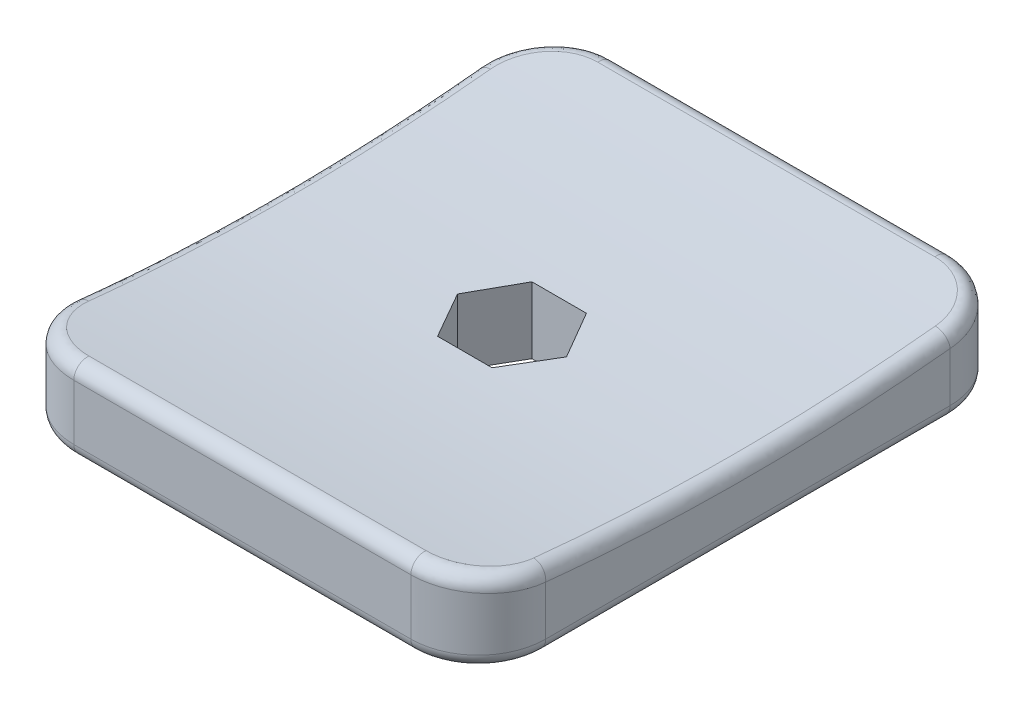
from build123d import *

# Parameters (mm, degrees)
BOSS_EXTRUDE1_DEPTH = 6.27
CUT_EXTRUDE2_DEPTH  = 41.795991225
FILLET1_R           = 1


with BuildPart() as part:
    # Sketch1 → Boss-Extrude1 (new body)
    with BuildSketch(Plane(origin=(0, 0, 0), x_dir=(1, 0, 0), z_dir=(0, 1, 0))):
        with BuildLine():
            Line((12.5, -20), (-12.5, -20))
            ThreePointArc((-12.5, -20), (-16.035533906, -18.535533906), (-17.5, -15))
            Line((-17.5, -15), (-17.5, 15))
            ThreePointArc((-17.5, 15), (-16.035533906, 18.535533906), (-12.5, 20))
            Line((-12.5, 20), (12.5, 20))
            ThreePointArc((12.5, 20), (16.035533906, 18.535533906), (17.5, 15))
            Line((17.5, 15), (17.5, -15))
            ThreePointArc((17.5, -15), (16.035533906, -18.535533906), (12.5, -20))
        make_face()
        Polygon((4.041451884, 0), (2.020725942, 3.5), (-2.020725942, 3.5), (-4.041451884, 0), (-2.020725942, -3.5), (2.020725942, -3.5), align=None, mode=Mode.SUBTRACT)
    extrude(amount=-BOSS_EXTRUDE1_DEPTH)

    # Sketch5 → Cut-Extrude2 (cut, through all)
    with BuildSketch(Plane(origin=(17.5, 0, 0), x_dir=(0, 0, -1), z_dir=(1, 0, 0))):
        with BuildLine():
            Line((-20, 0), (20, 0))
            add(Edge.make_bspline(
                [(-20, 0), (0, -2.74), (20, 0)],
                knots=[0, 0, 0, 1, 1, 1], degree=2))
        make_face()
    extrude(amount=-CUT_EXTRUDE2_DEPTH, mode=Mode.SUBTRACT)

    # Fillet1
    fillet1_edges = [part.edges().sort_by_distance(p)[0] for p in [
        (-16.035533906, -6.27, -18.535533906),
        (0, 0, -20),
        (-17.5, -6.27, 0),
        (-16.035533906, -6.27, 18.535533906),
        (0, -6.27, 20),
        (16.035533906, -6.27, 18.535533906),
        (17.5, -6.27, 0),
        (16.035533906, -6.27, -18.535533906),
        (17.5, -1.37, 0),
        (16.040764949, -0.193951453, -18.530295111),
        (16.040764953, -0.193951454, 18.530295108),
        (-16.040764959, -0.193951455, 18.530295101),
        (-16.040764959, -0.193951454, -18.5302951),
        (-17.5, -1.37, 0),
        (0, -6.27, -20),
        (0, 0, 20),
    ]]
    fillet(fillet1_edges, radius=FILLET1_R)


solid = part.part
